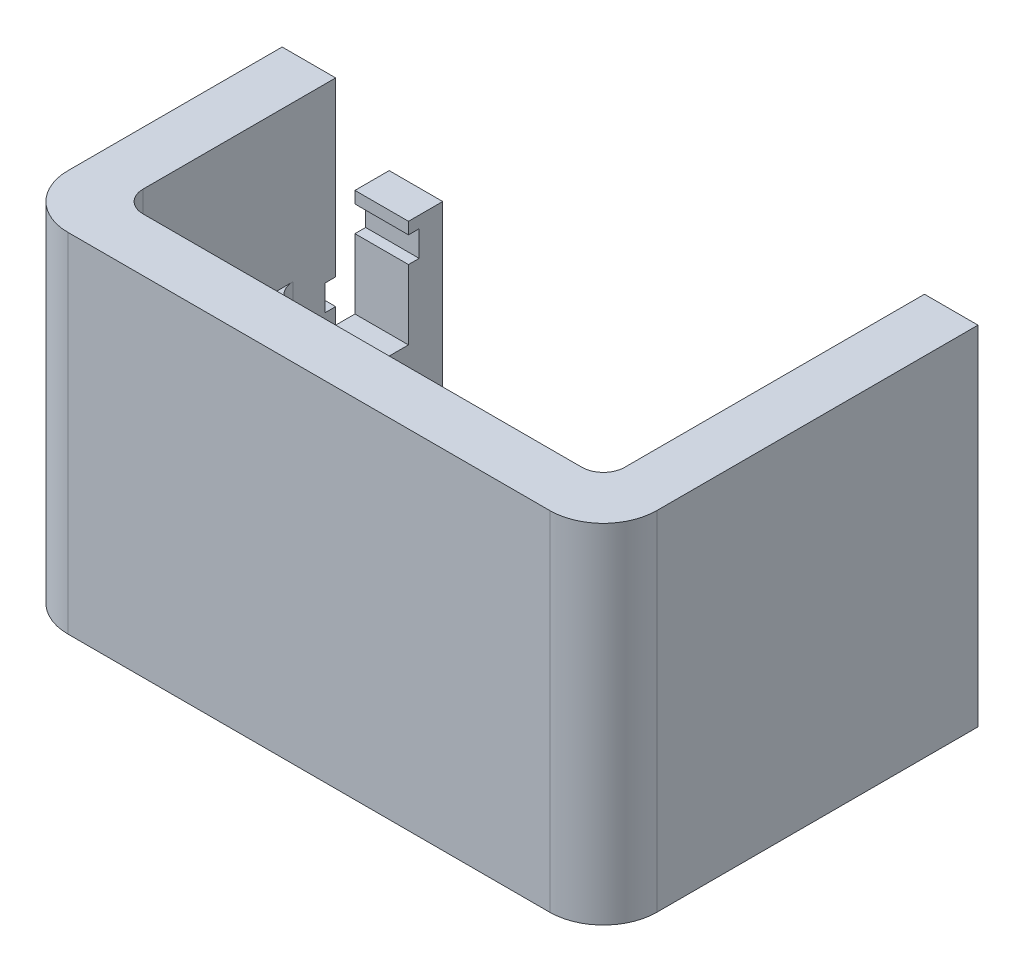
from build123d import *

# Parameters (mm, degrees)
BOSS_EXTRUDE1_DEPTH   = 38.1
SKETCH5_W             = 7.62
SKETCH5_H             = 3.175
BOSS_EXTRUDE2_DEPTH   = 10.16
F_6_CLEARANCE_HOLE1_D = 3.7973
BOSS_EXTRUDE3_DEPTH   = 3.175
FILLET1_R             = 6.35
FILLET2_R             = 2.54
FILLET3_R             = 2.54
FILLET4_R             = 2.54
BOSS_EXTRUDE6_DEPTH   = 6.35
CUT_EXTRUDE1_REACH    = 86.541
SKETCH19_W            = 1.27
SKETCH19_H            = 3.048


with BuildPart() as part:
    # Sketch1 → Boss-Extrude1 (new body)
    with BuildSketch(Plane(origin=(0, 0, 0), x_dir=(1, 0, 0), z_dir=(0, 1, 0))):
        Polygon((-34.925, -15.875), (34.925, -15.875), (34.925, 15.875), (34.925, 28.575), (28.575, 28.575), (28.575, 15.875), (28.575, -9.525), (-28.575, -9.525), (-28.575, 15.875), (-34.925, 15.875), align=None)
    extrude(amount=BOSS_EXTRUDE1_DEPTH)

    # Sketch5 → Boss-Extrude2 (add)
    with BuildSketch(Plane(origin=(-28.575, 0, 0), x_dir=(0, 0, -1), z_dir=(1, 0, 0))):
        with Locations((4.445, 18.0975)):
            Rectangle(SKETCH5_W, SKETCH5_H)
    boss_extrude2 = extrude(amount=BOSS_EXTRUDE2_DEPTH)

    # #6 Clearance Hole1 (through all)
    with Locations(Plane(origin=(0, 19.685, 0), x_dir=(1, 0, 0), z_dir=(0, 1, 0))):
        with Locations((-23.241, 4.445)):
            f_6_clearance_hole1 = Hole(F_6_CLEARANCE_HOLE1_D / 2)

    # Mirror4: Boss-Extrude2, #6 Clearance Hole1 across plane
    add(boss_extrude2.mirror(Plane(origin=(0, 0, 0), x_dir=(0, 0, 1), z_dir=(1, 0, 0))))
    add(f_6_clearance_hole1.mirror(Plane(origin=(0, 0, 0), x_dir=(0, 0, 1), z_dir=(1, 0, 0))), mode=Mode.SUBTRACT)

    # Sketch11 → Boss-Extrude3 (add)
    with BuildSketch(Plane.XZ):
        Polygon((-28.575, -28.575), (-28.575, 9.525), (28.575, 9.525), (28.575, -28.575), (34.925, -28.575), (34.925, 15.875), (-34.925, 15.875), (-34.925, -28.575), align=None)
    extrude(amount=BOSS_EXTRUDE3_DEPTH)

    # Fillet1
    fillet1_edges = [part.edges().sort_by_distance(p)[0] for p in [
        (34.925, 17.4625, 15.875),
        (-34.925, 17.4625, 15.875),
    ]]
    fillet(fillet1_edges, radius=FILLET1_R)

    # Fillet2
    fillet2_edges = [part.edges().sort_by_distance(p)[0] for p in [
        (-28.575, 18.0975, -8.255),
        (-28.575, 18.0975, -0.635),
        (28.575, 18.0975, -0.635),
        (28.575, 18.0975, -8.255),
    ]]
    fillet(fillet2_edges, radius=FILLET2_R)

    # Fillet3
    fillet3_edges = [part.edges().sort_by_distance(p)[0] for p in [
        (-28.575, 16.51, -4.445),
        (28.575, 16.51, -4.445),
    ]]
    fillet(fillet3_edges, radius=FILLET3_R)

    # Fillet4
    fillet4_edges = [part.edges().sort_by_distance(p)[0] for p in [
        (-28.575, 17.4625, 9.525),
        (28.575, 17.4625, 9.525),
    ]]
    fillet(fillet4_edges, radius=FILLET4_R)

    # Sketch18 → Boss-Extrude6 (add)
    with BuildSketch(Plane.ZY.offset(34.925)):
        Polygon((-24.511, 19.05), (-28.575, 19.05), (-28.575, 0), (-15.875, 0), (-15.875, 6.35), (-24.511, 6.35), align=None)
    extrude(amount=-BOSS_EXTRUDE6_DEPTH)

    # Sketch19 → Cut-Extrude1 (cut, up to next)
    with BuildSketch(Plane.ZY.offset(34.925), mode=Mode.PRIVATE) as cut_extrude1_sk1:
        with Locations((-15.24, 16.129)):
            Rectangle(SKETCH19_W, SKETCH19_H)
    cut_extrude1_tool1 = extrude(cut_extrude1_sk1.sketch, amount=-CUT_EXTRUDE1_REACH, mode=Mode.PRIVATE) & part.part
    # Sketch19 → Cut-Extrude1 (cut, up to next)
    with BuildSketch(Plane.ZY.offset(34.925), mode=Mode.PRIVATE) as cut_extrude1_sk2:
        with Locations((-25.146, 16.129)):
            Rectangle(SKETCH19_W, SKETCH19_H)
    cut_extrude1_tool2 = extrude(cut_extrude1_sk2.sketch, amount=-CUT_EXTRUDE1_REACH, mode=Mode.PRIVATE) & part.part
    add(cut_extrude1_tool1.solids().sort_by_distance((-34.925, 16.129, -15.24))[0], mode=Mode.SUBTRACT)
    add(cut_extrude1_tool2.solids().sort_by_distance((-34.925, 16.129, -25.146))[0], mode=Mode.SUBTRACT)


solid = part.part
